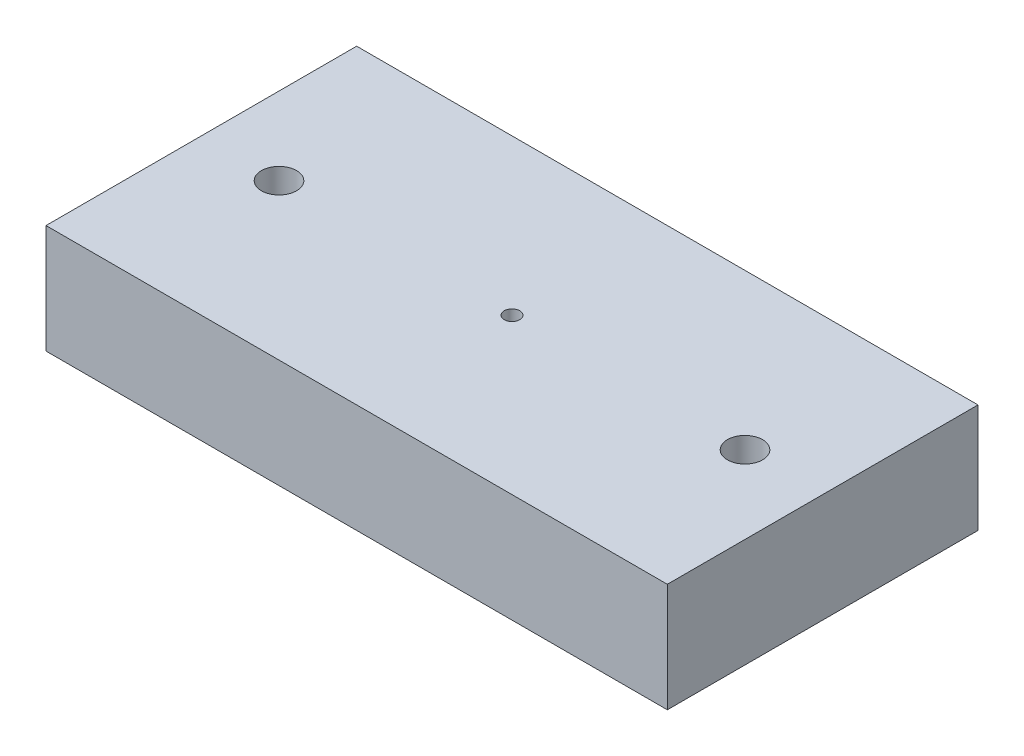
from build123d import *

# Parameters (mm, degrees)
SKETCH1_W                       = 40
SKETCH1_H                       = 20
BOSS_EXTRUDE1_DEPTH             = 7
SKETCH2_R                       = 0.5
CUT_EXTRUDE1_DEPTH              = 6.72
F_4_40_TAPPED_HOLE1_D           = 2.2606
F_4_40_TAPPED_HOLE1_CSINK_D     = 3.5306
F_4_40_TAPPED_HOLE1_CSINK_ANGLE = 90
LPATTERN1_COUNT                 = 2
LPATTERN1_PITCH                 = 30
SKETCH12_R                      = 5.55
SKETCH12_R_2                    = 3.97
CUT_EXTRUDE2_DEPTH              = 4.9
SKETCH13_W                      = 5
SKETCH13_H                      = 3.5
CUT_EXTRUDE3_DEPTH              = 0.5


with BuildPart() as part:
    # Sketch1 → Boss-Extrude1 (new body)
    with BuildSketch(Plane(origin=(0, 0, 0), x_dir=(1, 0, 0), z_dir=(0, 1, 0))):
        Rectangle(SKETCH1_W, SKETCH1_H)
    extrude(amount=BOSS_EXTRUDE1_DEPTH)

    # Sketch2 → Cut-Extrude1 (cut)
    with BuildSketch(Plane(origin=(0, 7, 0), x_dir=(1, 0, 0), z_dir=(0, 1, 0))):
        with Locations(Location((0, 0, 0), (0, 0, 270))):
            Circle(SKETCH2_R)
    extrude(amount=-CUT_EXTRUDE1_DEPTH, mode=Mode.SUBTRACT)

    # #4-40 Tapped Hole1 (through all)
    with Locations(Plane(origin=(-15, 0, 0), x_dir=(0, 0, -1), z_dir=(0, -1, 0))):
        with Locations((0, 0)):
            f_4_40_tapped_hole1 = CounterSinkHole(F_4_40_TAPPED_HOLE1_D / 2, F_4_40_TAPPED_HOLE1_CSINK_D / 2, counter_sink_angle=F_4_40_TAPPED_HOLE1_CSINK_ANGLE)

    # LPattern1: #4-40 Tapped Hole1 ×2
    with Locations(*[(i * LPATTERN1_PITCH, 0, 0) for i in range(1, LPATTERN1_COUNT)]):
        add(f_4_40_tapped_hole1, mode=Mode.SUBTRACT)

    # Sketch12 → Cut-Extrude2 (cut)
    with BuildSketch(Plane.XZ):
        with Locations(Location((0, 0, 0), (0, 0, 270))):
            Circle(SKETCH12_R)
        with Locations(Location((0, 0, 0), (0, 0, 270))):
            Circle(SKETCH12_R_2, mode=Mode.SUBTRACT)
    extrude(amount=-CUT_EXTRUDE2_DEPTH, mode=Mode.SUBTRACT)

    # Sketch13 → Cut-Extrude3 (cut)
    with BuildSketch(Plane.XZ):
        Rectangle(SKETCH13_W, SKETCH13_H)
    extrude(amount=-CUT_EXTRUDE3_DEPTH, mode=Mode.SUBTRACT)


solid = part.part
